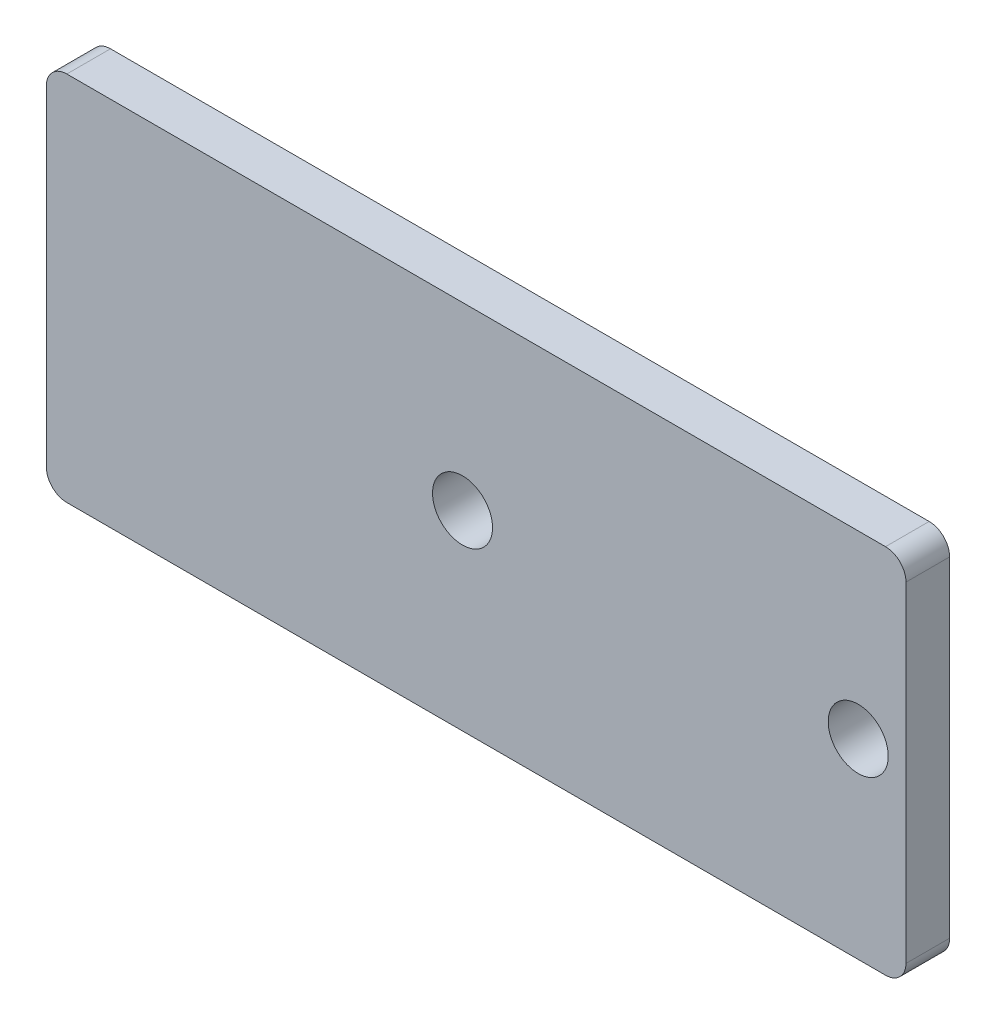
from build123d import *

# Parameters (mm, degrees)
MODEL_R             = 1.1
BOSS_EXTRUDE1_DEPTH = 0.8


with BuildPart() as part:
    # Model → Boss-Extrude1 (new, symmetric)
    with BuildSketch(Plane.XY):
        with BuildLine():
            Line((-15, -6.8), (15, -6.8))
            ThreePointArc((15, -6.8), (15.530330086, -6.580330086), (15.75, -6.05))
            Line((15.75, -6.05), (15.75, 6.05))
            ThreePointArc((15.75, 6.05), (15.530330086, 6.580330086), (15, 6.8))
            Line((15, 6.8), (-15, 6.8))
            ThreePointArc((-15, 6.8), (-15.530330086, 6.580330086), (-15.75, 6.05))
            Line((-15.75, 6.05), (-15.75, -6.05))
            ThreePointArc((-15.75, -6.05), (-15.530330086, -6.580330086), (-15, -6.8))
        make_face()
        with Locations((-0.5, 0.2)):
            Circle(MODEL_R, mode=Mode.SUBTRACT)
        with Locations((14, 0.2)):
            Circle(MODEL_R, mode=Mode.SUBTRACT)
    extrude(amount=BOSS_EXTRUDE1_DEPTH, both=True)


solid = part.part
